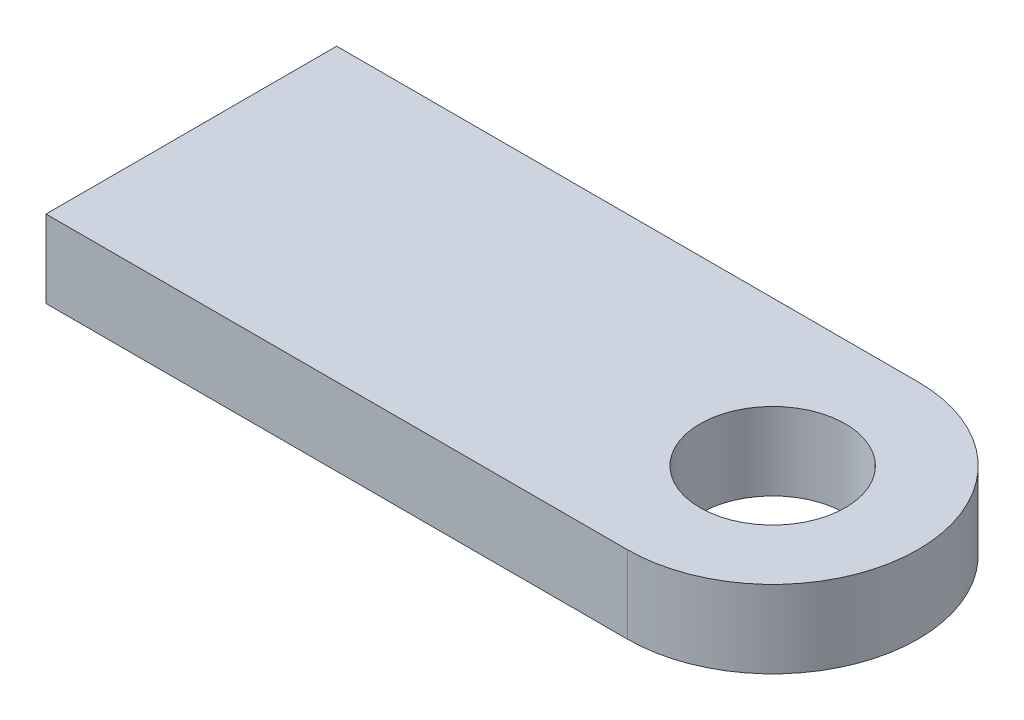
from build123d import *

# Parameters (mm, degrees)
BOSS_EXTRUDE1_DEPTH = 2.032
SKETCH2_R           = 1.905
CUT_EXTRUDE1_DEPTH  = 21.617854496


with BuildPart() as part:
    # Sketch1 → Boss-Extrude1 (new body)
    with BuildSketch(Plane(origin=(0, 0, 0), x_dir=(1, 0, 0), z_dir=(0, 1, 0))):
        with BuildLine():
            Line((0, 0), (15.24, 0))
            ThreePointArc((15.24, 0), (19.05, -3.81), (15.24, -7.62))
            Line((15.24, -7.62), (0, -7.62))
            Line((0, -7.62), (0, 0))
        make_face()
    extrude(amount=BOSS_EXTRUDE1_DEPTH)

    # Sketch2 → Cut-Extrude1 (cut, through all)
    with BuildSketch(Plane(origin=(0, 2.032, 0), x_dir=(1, 0, 0), z_dir=(0, 1, 0))):
        with Locations(Location((15.24, -3.81, 0), (0, 0, 270))):
            Circle(SKETCH2_R)
    extrude(amount=-CUT_EXTRUDE1_DEPTH, mode=Mode.SUBTRACT)


solid = part.part
